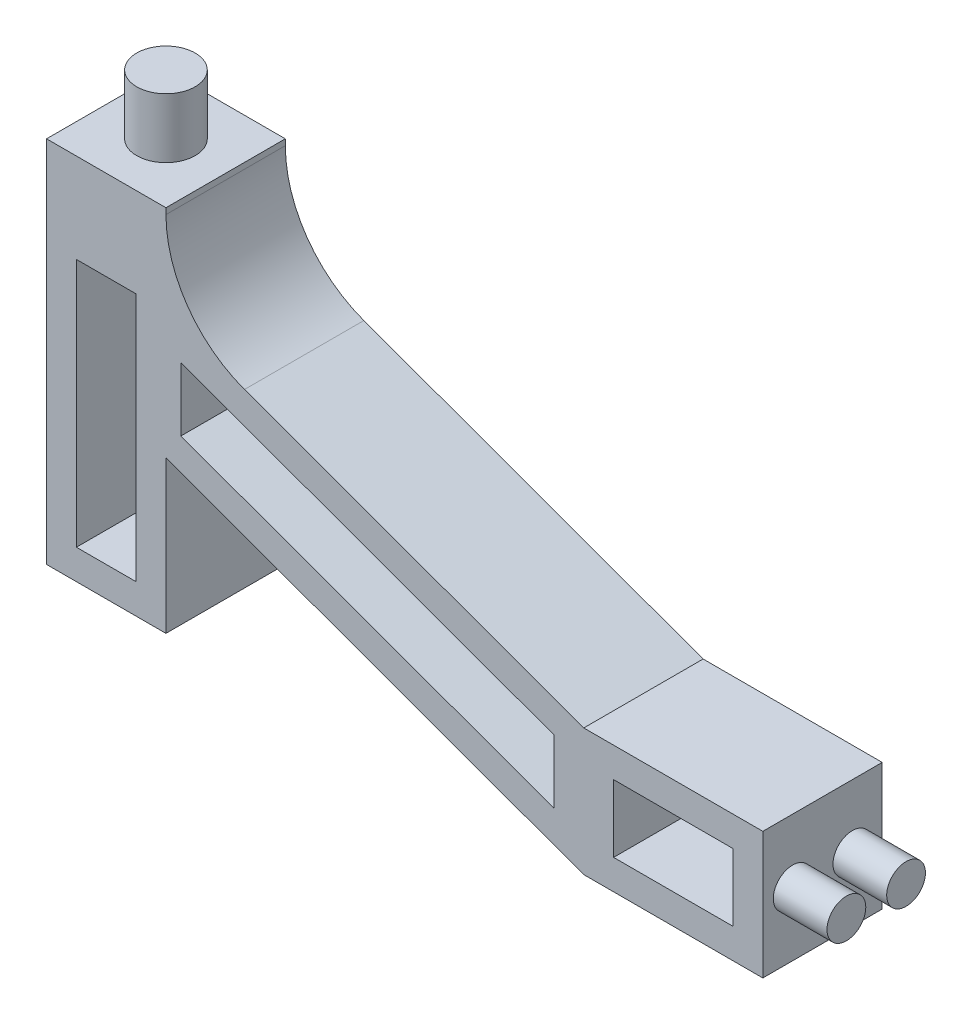
from build123d import *

# Parameters (mm, degrees)
ESQUISSE1_W             = 10
ESQUISSE1_H             = 41.761471848
ESQUISSE1_W_2           = 20
ESQUISSE1_H_2           = 11.28355545
BOSS_EXTRU_1_DEPTH      = 20
CONG_1_R                = 20
ESQUISSE2_R             = 4.9
BOSS_EXTRU_2_DEPTH      = 10
ESQUISSE4_W             = 62.840930267
ESQUISSE4_H             = 35.08297334
ENL_V_MAT_EXTRU_1_DEPTH = 10
ESQUISSE6_R             = 3.25
BOSS_EXTRU_3_DEPTH      = 9


with BuildPart() as part:
    # Esquisse1 → Boss.-Extru.1 (new body)
    with BuildSketch(Plane.XY):
        Polygon((0, 0), (0, 21.28355545), (-40, 21.28355545), (-110, 46.761471848), (-110, 61.761471848), (-130, 61.761471848), (-130, 0), (-110, 0), (-110, 25.477916399), (-40, 0), align=None)
        Polygon((-107.5, 40.5306574), (-45, 17.782517758), (-45, 7.140740034), (-107.5, 29.888879675), align=None, mode=Mode.SUBTRACT)
        with Locations((-120, 25.880735924)):
            Rectangle(ESQUISSE1_W, ESQUISSE1_H, mode=Mode.SUBTRACT)
        with Locations((-25, 10.641777725)):
            Rectangle(ESQUISSE1_W_2, ESQUISSE1_H_2, mode=Mode.SUBTRACT)
    extrude(amount=BOSS_EXTRU_1_DEPTH)

    # Congé1
    cong_1_edges = [part.edges().sort_by_distance(p)[0] for p in [
        (-110, 46.761471848, 10),
    ]]
    fillet(cong_1_edges, radius=CONG_1_R)

    # Esquisse2 → Boss.-Extru.2 (add)
    with BuildSketch(Plane(origin=(0, 61.761471848, 0), x_dir=(1, 0, 0), z_dir=(0, 1, 0))):
        with Locations(Location((-120, -10, 0), (0, 0, 270))):
            Circle(ESQUISSE2_R)
    extrude(amount=BOSS_EXTRU_2_DEPTH)

    # Esquisse4 → Enlèv. mat.-Extru.1 (cut)
    with BuildSketch(Plane(origin=(0, 0, 0), x_dir=(0, 0, -1), z_dir=(1, 0, 0))):
        with Locations((-15.686525899, 12.319682914)):
            Rectangle(ESQUISSE4_W, ESQUISSE4_H)
    extrude(amount=-ENL_V_MAT_EXTRU_1_DEPTH, mode=Mode.SUBTRACT)

    # Esquisse6 → Boss.-Extru.3 (add)
    with BuildSketch(Plane(origin=(-10, 0, 0), x_dir=(0, 0, -1), z_dir=(1, 0, 0))):
        with Locations((-15, 10.641777725)):
            Circle(ESQUISSE6_R)
        with Locations(Location((-5, 10.641777725, 0), (0, 0, 180))):
            Circle(ESQUISSE6_R)
    extrude(amount=BOSS_EXTRU_3_DEPTH)


solid = part.part
